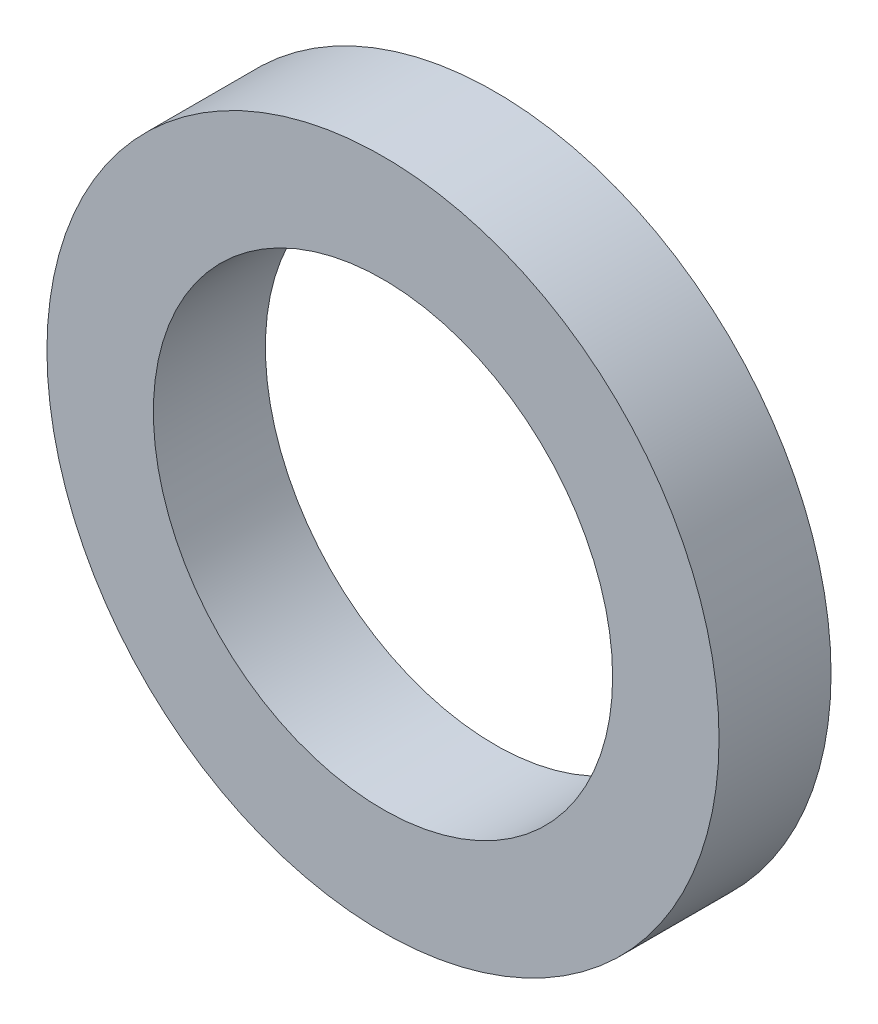
from build123d import *

# Parameters (mm, degrees)
SKETCH1_R           = 6
SKETCH1_R_2         = 4.1
BOSS_EXTRUDE1_DEPTH = 2


with BuildPart() as part:
    # Sketch1 → Boss-Extrude1 (new body)
    with BuildSketch(Plane(origin=(0, 0, 0), x_dir=(0, 1, 0), z_dir=(0, 0, 1))):
        with Locations(Location((0, 0, 0), (0, 0, 270))):
            Circle(SKETCH1_R)
        with Locations(Location((0, 0, 0), (0, 0, 270))):
            Circle(SKETCH1_R_2, mode=Mode.SUBTRACT)
    extrude(amount=BOSS_EXTRUDE1_DEPTH)


solid = part.part
